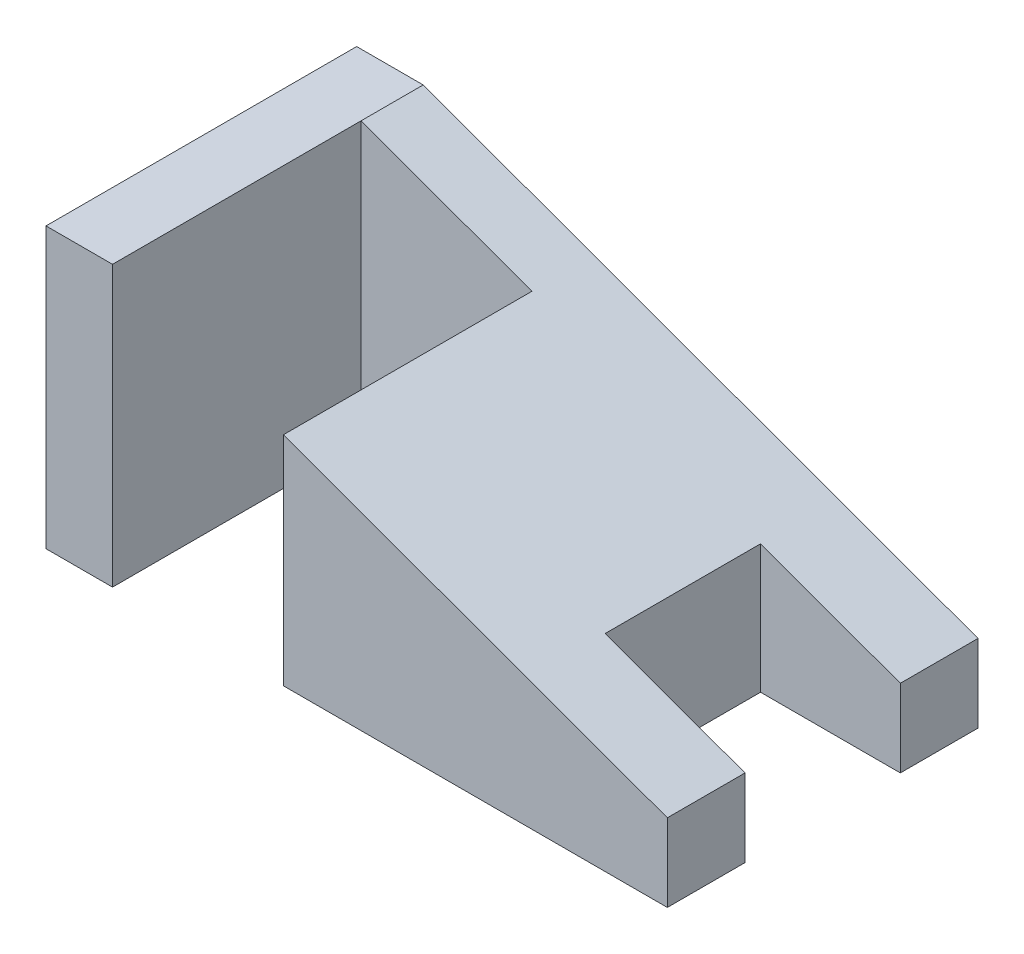
from build123d import *

# Parameters (mm, degrees)
BOSS_EXTRUDE1_DEPTH = 100
CUT_EXTRUDE1_REACH  = 243.039
SKETCH2_W           = 55
SKETCH2_H           = 80
SKETCH2_W_2         = 45
SKETCH2_H_2         = 50


with BuildPart() as part:
    # Sketch1 → Boss-Extrude1 (new body)
    with BuildSketch(Plane.XY):
        Polygon((0, 0), (200, 0), (200, 25), (21.413967735, 90), (0, 90), align=None)
    extrude(amount=BOSS_EXTRUDE1_DEPTH)

    # Sketch2 → Cut-Extrude1 (cut, up to next)
    with BuildSketch(Plane(origin=(0, 90, 0), x_dir=(1, 0, 0), z_dir=(0, 1, 0)), mode=Mode.PRIVATE) as cut_extrude1_sk1:
        with Locations((48.913967735, -60)):
            Rectangle(SKETCH2_W, SKETCH2_H)
    cut_extrude1_tool1 = extrude(cut_extrude1_sk1.sketch, amount=-CUT_EXTRUDE1_REACH, mode=Mode.PRIVATE) & part.part
    # Sketch2 → Cut-Extrude1 (cut, up to next)
    with BuildSketch(Plane(origin=(0, 90, 0), x_dir=(1, 0, 0), z_dir=(0, 1, 0)), mode=Mode.PRIVATE) as cut_extrude1_sk2:
        with Locations((177.5, -50)):
            Rectangle(SKETCH2_W_2, SKETCH2_H_2)
    cut_extrude1_tool2 = extrude(cut_extrude1_sk2.sketch, amount=-CUT_EXTRUDE1_REACH, mode=Mode.PRIVATE) & part.part
    add(cut_extrude1_tool1.solids().sort_by_distance((48.913968, 90, 60))[0], mode=Mode.SUBTRACT)
    add(cut_extrude1_tool2.solids().sort_by_distance((177.5, 90, 50))[0], mode=Mode.SUBTRACT)


solid = part.part
